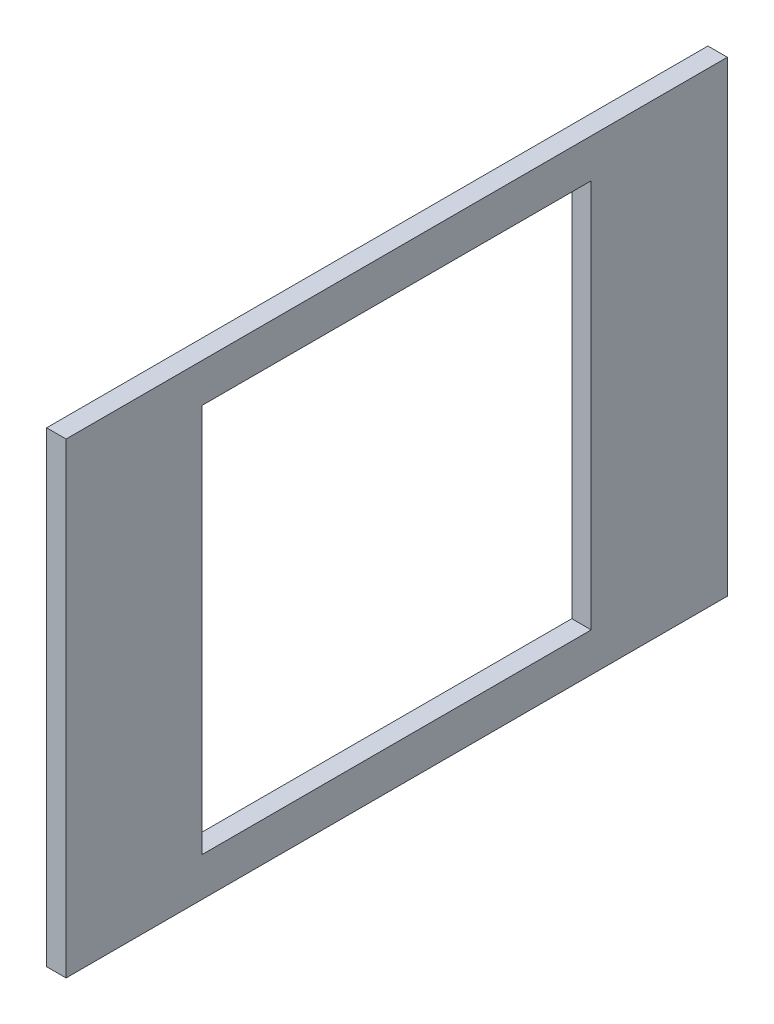
from build123d import *

# Parameters (mm, degrees)
SKETCH1_W           = 431.8
SKETCH1_H           = 304.8
SKETCH1_W_2         = 254
SKETCH1_H_2         = 254
BOSS_EXTRUDE1_DEPTH = 12.7


with BuildPart() as part:
    # Sketch1 → Boss-Extrude1 (new body)
    with BuildSketch(Plane(origin=(0, 0, 0), x_dir=(0, 0, -1), z_dir=(1, 0, 0))):
        Rectangle(SKETCH1_W, SKETCH1_H)
        Rectangle(SKETCH1_W_2, SKETCH1_H_2, mode=Mode.SUBTRACT)
    extrude(amount=BOSS_EXTRUDE1_DEPTH)


solid = part.part
